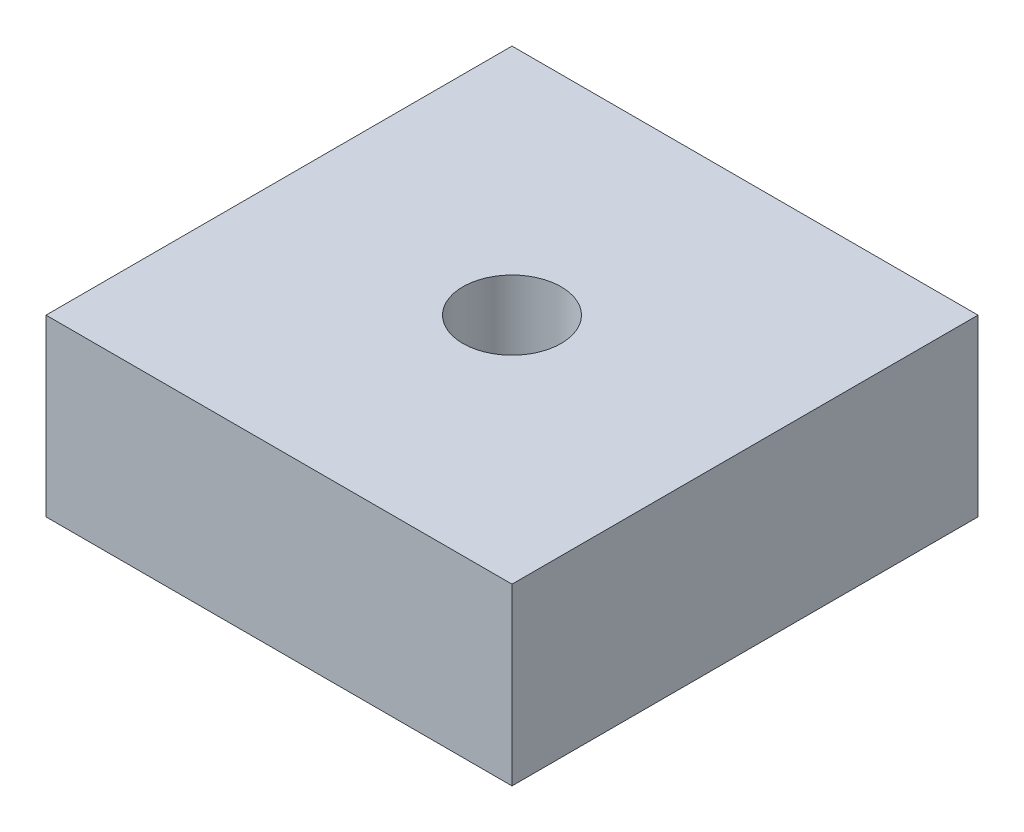
from build123d import *

# Parameters (mm, degrees)
SKETCH1_W               = 50.8
SKETCH1_H               = 19.05
EXTRUDE1_DEPTH          = 50.8
F_1_2_13_TAPPED_HOLE1_D = 10.71626


with BuildPart() as part:
    # Sketch1 → Extrude1 (new body)
    with BuildSketch(Plane.XY):
        with Locations((25.4, 9.525)):
            Rectangle(SKETCH1_W, SKETCH1_H)
    extrude(amount=EXTRUDE1_DEPTH)

    # 1/2-13 Tapped Hole1 (through all)
    with Locations(Plane(origin=(0, 19.05, 0), x_dir=(-1, 0, 0), z_dir=(0, 1, 0))):
        with Locations((-25.4, 25.4)):
            Hole(F_1_2_13_TAPPED_HOLE1_D / 2)


solid = part.part
